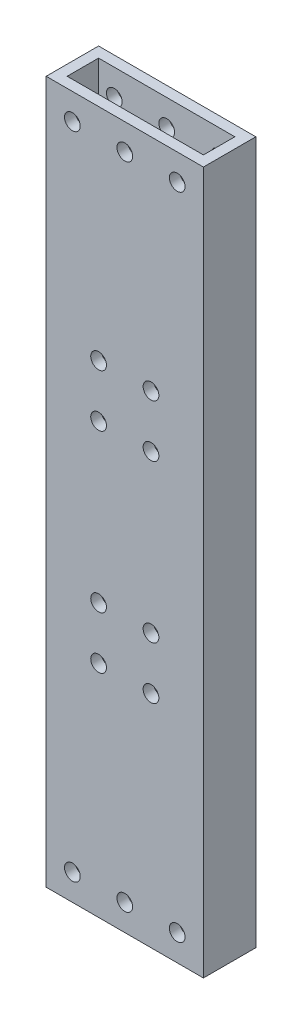
from build123d import *

# Parameters (mm, degrees)
SKETCH_1_W          = 30
SKETCH_1_H          = 10
SKETCH_1_W_2        = 26
SKETCH_1_H_2        = 6
EXTRUDE_1_DEPTH     = 67
SKETCH_2_R          = 1.5
CUT_EXTRUDE_1_DEPTH = 70.382995035


with BuildPart() as part:
    # 草图1 → 凸台-拉伸1 (new, symmetric)
    with BuildSketch(Plane(origin=(0, 0, 0), x_dir=(1, 0, 0), z_dir=(0, 1, 0))):
        Rectangle(SKETCH_1_W, SKETCH_1_H)
        Rectangle(SKETCH_1_W_2, SKETCH_1_H_2, mode=Mode.SUBTRACT)
    extrude(amount=EXTRUDE_1_DEPTH, both=True)

    # 草图2 → 切除-拉伸1 (cut, through all)
    with BuildSketch(Plane.XY.offset(5)):
        with Locations((-10, 62)):
            Circle(SKETCH_2_R)
        with Locations((0, 62)):
            Circle(SKETCH_2_R)
        with Locations((10, 62)):
            Circle(SKETCH_2_R)
        with Locations((-5, 25)):
            Circle(SKETCH_2_R)
        with Locations((-5, 15)):
            Circle(SKETCH_2_R)
        with Locations((5, 15)):
            Circle(SKETCH_2_R)
        with Locations((5, 25)):
            Circle(SKETCH_2_R)
        with Locations(Location((-5, -15, 0), (0, 0, 180))):
            Circle(SKETCH_2_R)
        with Locations(Location((5, -15, 0), (0, 0, 180))):
            Circle(SKETCH_2_R)
        with Locations(Location((5, -25, 0), (0, 0, 180))):
            Circle(SKETCH_2_R)
        with Locations(Location((-5, -25, 0), (0, 0, 180))):
            Circle(SKETCH_2_R)
        with Locations(Location((-10, -62, 0), (0, 0, 180))):
            Circle(SKETCH_2_R)
        with Locations(Location((0, -62, 0), (0, 0, 180))):
            Circle(SKETCH_2_R)
        with Locations(Location((10, -62, 0), (0, 0, 180))):
            Circle(SKETCH_2_R)
    extrude(amount=-CUT_EXTRUDE_1_DEPTH, mode=Mode.SUBTRACT)


solid = part.part
